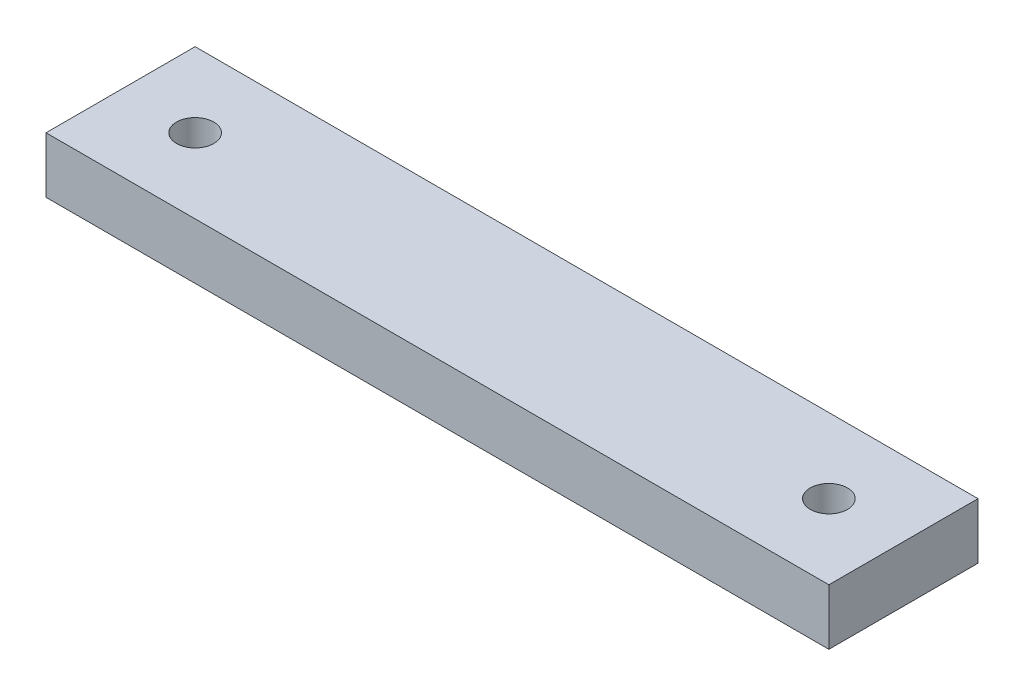
from build123d import *

# Parameters (mm, degrees)
SKETCH1_W           = 210
SKETCH1_H           = 40
SKETCH1_R           = 5
BOSS_EXTRUDE1_DEPTH = 15


with BuildPart() as part:
    # Sketch1 → Boss-Extrude1 (new body)
    with BuildSketch(Plane(origin=(0, 0, 0), x_dir=(1, 0, 0), z_dir=(0, 1, 0))):
        Rectangle(SKETCH1_W, SKETCH1_H)
        with Locations(Location((-85, 0, 0), (0, 0, 270))):
            Circle(SKETCH1_R, mode=Mode.SUBTRACT)
        with Locations(Location((85, 0, 0), (0, 0, 90))):
            Circle(SKETCH1_R, mode=Mode.SUBTRACT)
    extrude(amount=BOSS_EXTRUDE1_DEPTH)


solid = part.part
